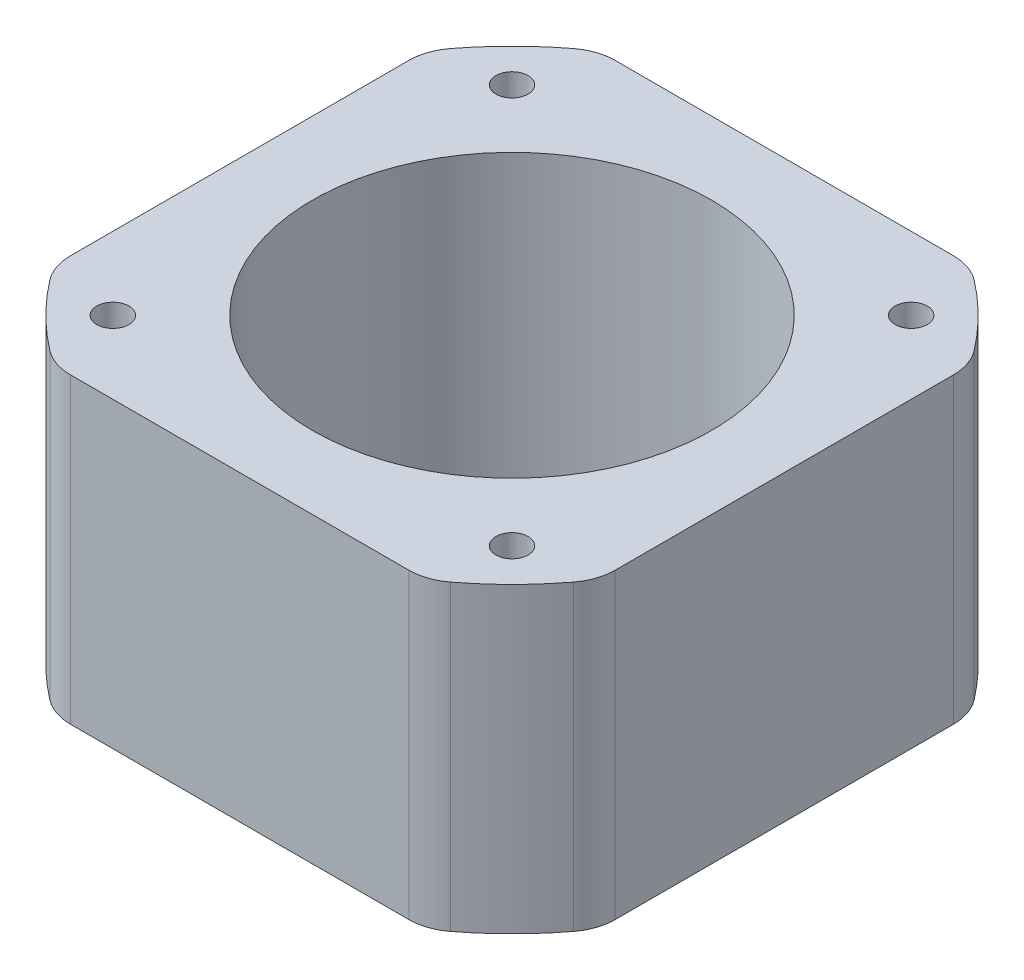
from build123d import *

# Parameters (mm, degrees)
SKETCH_1_R      = 1.25
SKETCH_1_R_2    = 15.5
EXTRUDE_1_DEPTH = 23.5
FILLET_1_R      = 4


with BuildPart() as part:
    # Эскиз1 → Бобышка-Вытянуть1 (new body)
    with BuildSketch(Plane(origin=(0, 0, 0), x_dir=(1, 0, 0), z_dir=(0, 1, 0))):
        with BuildLine():
            Line((-14.423505122, -21.15), (14.423505122, -21.15))
            ThreePointArc((14.423505122, -21.15), (18.101933598, -18.101933598), (21.15, -14.423505122))
            Line((21.15, -14.423505122), (21.15, 14.423505122))
            ThreePointArc((21.15, 14.423505122), (18.101933598, 18.101933598), (14.423505122, 21.15))
            Line((14.423505122, 21.15), (-14.423505122, 21.15))
            ThreePointArc((-14.423505122, 21.15), (-18.101933598, 18.101933598), (-21.15, 14.423505122))
            Line((-21.15, 14.423505122), (-21.15, -14.423505122))
            ThreePointArc((-21.15, -14.423505122), (-18.101933598, -18.101933598), (-14.423505122, -21.15))
        make_face()
        with Locations(Location((-15.5, 15.5, 0), (0, 0, 270))):
            Circle(SKETCH_1_R, mode=Mode.SUBTRACT)
        with Locations(Location((15.5, 15.5, 0), (0, 0, 270))):
            Circle(SKETCH_1_R, mode=Mode.SUBTRACT)
        with Locations(Location((15.5, -15.5, 0), (0, 0, 270))):
            Circle(SKETCH_1_R, mode=Mode.SUBTRACT)
        with Locations(Location((-15.5, -15.5, 0), (0, 0, 270))):
            Circle(SKETCH_1_R, mode=Mode.SUBTRACT)
        with Locations(Location((0, 0, 0), (0, 0, 270))):
            Circle(SKETCH_1_R_2, mode=Mode.SUBTRACT)
    extrude(amount=EXTRUDE_1_DEPTH)

    # Скругление1
    fillet_1_edges = [part.edges().sort_by_distance(p)[0] for p in [
        (21.15, 11.75, -14.423505122),
        (21.15, 11.75, 14.423505122),
        (14.423505122, 11.75, 21.15),
        (-14.423505122, 11.75, 21.15),
        (-21.15, 11.75, 14.423505122),
        (-21.15, 11.75, -14.423505122),
        (-14.423505122, 11.75, -21.15),
        (14.423505122, 11.75, -21.15),
    ]]
    fillet(fillet_1_edges, radius=FILLET_1_R)


solid = part.part
